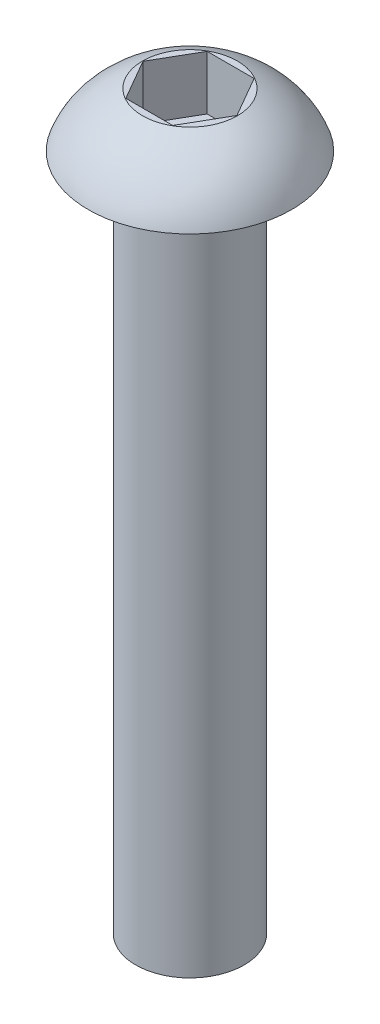
from build123d import *

# Parameters (mm, degrees)
SKETCH15_W           = 2
SKETCH15_H           = 25
SKETCH19_R           = 1.75
BOSS_EXTRUDE11_DEPTH = 2


with BuildPart() as part:
    # Sketch15 → Revolve3 (revolve)
    with BuildSketch(Plane(origin=(0, 0, 0), x_dir=(0, 0, -1), z_dir=(1, 0, 0))):
        Rectangle(SKETCH15_W, SKETCH15_H)
        with BuildLine():
            Line((0.75, 14.5), (0.75, 12.5))
            Line((0.75, 12.5), (1, 12.5))
            Line((1, 12.5), (2.75, 12.5))
            add(Edge.make_bspline(
                [(0.75, 14.5), (2.290975881, 13.819572534), (2.75, 12.5)],
                knots=[0, 0, 0, 0.856055689, 0.856055689, 0.856055689], degree=2))
        make_face()
    revolve(axis=Axis((0, -12.5, 1), (0, 1, 0)))

    # Sketch19 → Boss-Extrude11 (add)
    with BuildSketch(Plane(origin=(0, 12.5, 0), x_dir=(1, 0, 0), z_dir=(0, 1, 0))):
        with Locations((0, -1)):
            Circle(SKETCH19_R)
        Polygon((1.732050808, -1), (0.866025404, 0.5), (-0.866025404, 0.5), (-1.732050808, -1), (-0.866025404, -2.5), (0.866025404, -2.5), align=None, mode=Mode.SUBTRACT)
    extrude(amount=BOSS_EXTRUDE11_DEPTH)


solid = part.part
